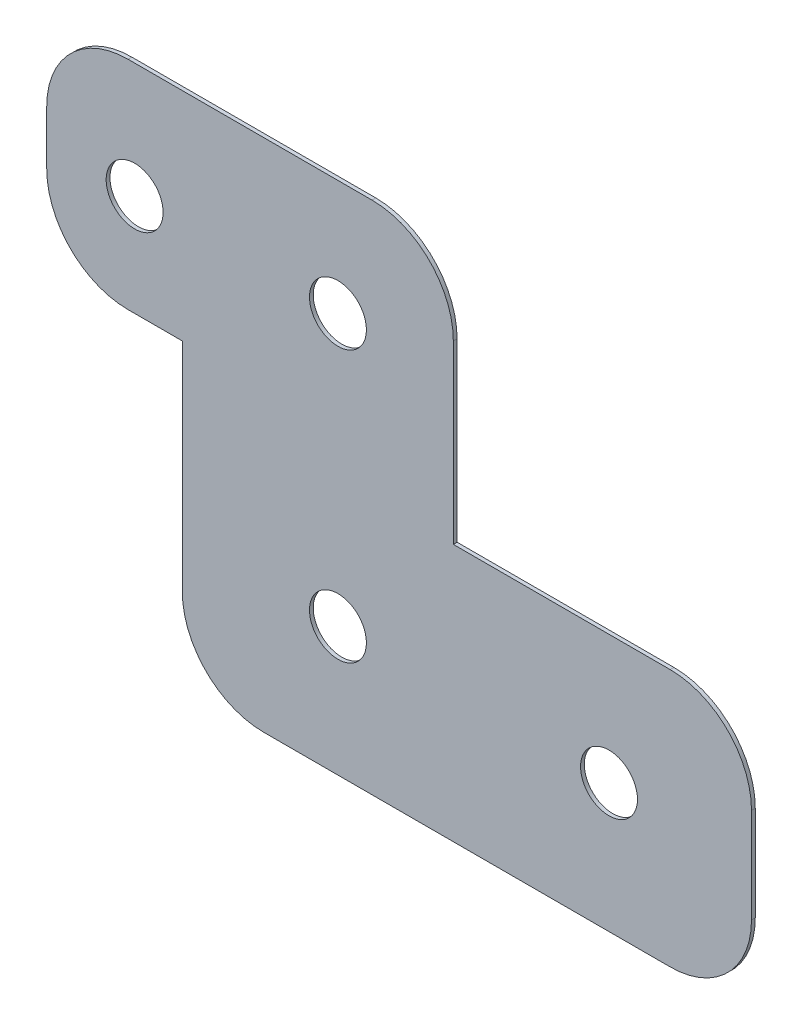
from build123d import *

# Parameters (mm, degrees)
SKETCH1_W           = 520
SKETCH1_H           = 380
BOSS_EXTRUDE1_DEPTH = 2.778125
SKETCH2_W           = 220
SKETCH2_H           = 190
CUT_EXTRUDE1_DEPTH  = 2.778125
SKETCH3_W           = 100
SKETCH3_H           = 220
CUT_EXTRUDE2_DEPTH  = 2.778125
FILLET2_R           = 60
FILLET3_R           = 60
SKETCH4_R           = 21
CUT_EXTRUDE3_DEPTH  = 2.778125


with BuildPart() as part:
    # Sketch1 → Boss-Extrude1 (new body)
    with BuildSketch(Plane.XY):
        with Locations((-200, 190)):
            Rectangle(SKETCH1_W, SKETCH1_H)
    extrude(amount=BOSS_EXTRUDE1_DEPTH)

    # Sketch2 → Cut-Extrude1 (cut)
    with BuildSketch(Plane.XY.offset(2.778125)):
        with Locations((-50, 285)):
            Rectangle(SKETCH2_W, SKETCH2_H)
    extrude(amount=-CUT_EXTRUDE1_DEPTH, mode=Mode.SUBTRACT)

    # Sketch3 → Cut-Extrude2 (cut)
    with BuildSketch(Plane.XY.offset(2.778125)):
        with Locations((-410, 110)):
            Rectangle(SKETCH3_W, SKETCH3_H)
    extrude(amount=-CUT_EXTRUDE2_DEPTH, mode=Mode.SUBTRACT)

    # Fillet2
    fillet2_edges = [part.edges().sort_by_distance(p)[0] for p in [
        (-460, 220, 1.3890625),
        (-460, 380, 1.3890625),
    ]]
    fillet(fillet2_edges, radius=FILLET2_R)

    # Fillet3
    fillet3_edges = [part.edges().sort_by_distance(p)[0] for p in [
        (60, 190, 1.3890625),
        (-160, 380, 1.3890625),
        (-360, 0, 1.3890625),
        (60, 0, 1.3890625),
    ]]
    fillet(fillet3_edges, radius=FILLET3_R)

    # Sketch4 → Cut-Extrude3 (cut)
    with BuildSketch(Plane.XY.offset(2.778125)):
        with Locations((-395.138918322, 295)):
            Circle(SKETCH4_R)
        with Locations((-245.138918322, 295)):
            Circle(SKETCH4_R)
        with Locations((-245.138918322, 95)):
            Circle(SKETCH4_R)
        with Locations((-45.138918322, 95)):
            Circle(SKETCH4_R)
    extrude(amount=-CUT_EXTRUDE3_DEPTH, mode=Mode.SUBTRACT)


solid = part.part
